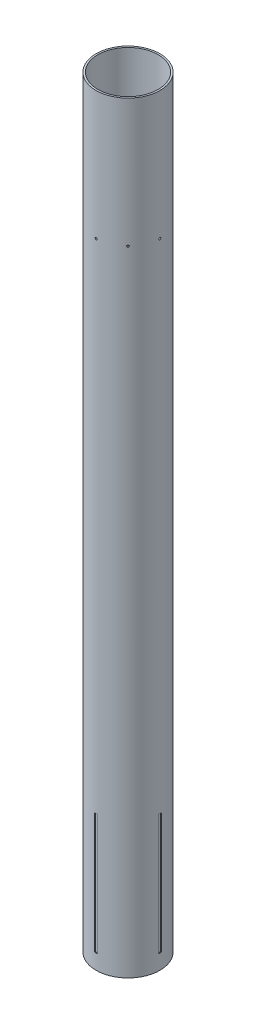
from build123d import *

# Parameters (mm, degrees)
SKETCH1_R                    = 53.721
SKETCH1_R_2                  = 50.8
TUBE_EXTRUSION_DEPTH         = 1282.7
ENGINE_BLOCK_HOLE_REACH      = 1290.312
ENGINE_BLOCK_HOLE_END_RADIUS = 50.8
SKETCH2_R                    = 1.6383
CIRPATTERN1_COUNT            = 8
SKETCH3_W                    = 5.334
SKETCH3_H                    = 203.2
FIN_SLOTS_DEPTH              = 1.27
CIRPATTERN2_COUNT            = 4


with BuildPart() as part:
    # Sketch1 → Tube Extrusion (new body)
    with BuildSketch(Plane(origin=(0, 0, 0), x_dir=(1, 0, 0), z_dir=(0, 1, 0))):
        with Locations(Location((0, 0, 0), (0, 0, 90))):
            Circle(SKETCH1_R)
        with Locations(Location((0, 0, 0), (0, 0, 90))):
            Circle(SKETCH1_R_2, mode=Mode.SUBTRACT)
    extrude(amount=TUBE_EXTRUSION_DEPTH)

    # Engine Block Hole: up to this cylinder (the profile starts outside it)
    engine_block_hole_end = Plane(origin=(0, 1066.8, 0), z_dir=(0, -1, 0)) * Cylinder(ENGINE_BLOCK_HOLE_END_RADIUS, 2683.224, mode=Mode.PRIVATE)
    # Sketch2 → Engine Block Hole (cut, up to the surface)
    with BuildSketch(Plane.XY.offset(53.721), mode=Mode.PRIVATE) as engine_block_hole_sk1:
        with Locations((0, 1066.8)):
            Circle(SKETCH2_R)
    engine_block_hole_tool1 = extrude(engine_block_hole_sk1.sketch, amount=-ENGINE_BLOCK_HOLE_REACH, mode=Mode.PRIVATE) - engine_block_hole_end
    engine_block_hole = engine_block_hole_tool1.solids().sort_by_distance((0, 1066.8, 53.721))[0]
    add(engine_block_hole, mode=Mode.SUBTRACT)

    # CirPattern1: Engine Block Hole ×8 about axis
    cirpattern1_axis = Axis((0, 1282.7, 0), (0, -1, 0))
    for i in range(1, CIRPATTERN1_COUNT):
        add(engine_block_hole.rotate(cirpattern1_axis, i * 360 / CIRPATTERN1_COUNT), mode=Mode.SUBTRACT)

    # Sketch3 → Fin Slots (cut)
    with BuildSketch(Plane.XY.offset(53.721)):
        with Locations((0, 127)):
            Rectangle(SKETCH3_W, SKETCH3_H)
    fin_slots = extrude(amount=-FIN_SLOTS_DEPTH, mode=Mode.SUBTRACT)

    # CirPattern2: Fin Slots ×4 about axis
    cirpattern2_axis = Axis((0, 0, 0), (0, 1, 0))
    for i in range(1, CIRPATTERN2_COUNT):
        add(fin_slots.rotate(cirpattern2_axis, i * 360 / CIRPATTERN2_COUNT), mode=Mode.SUBTRACT)


solid = part.part
